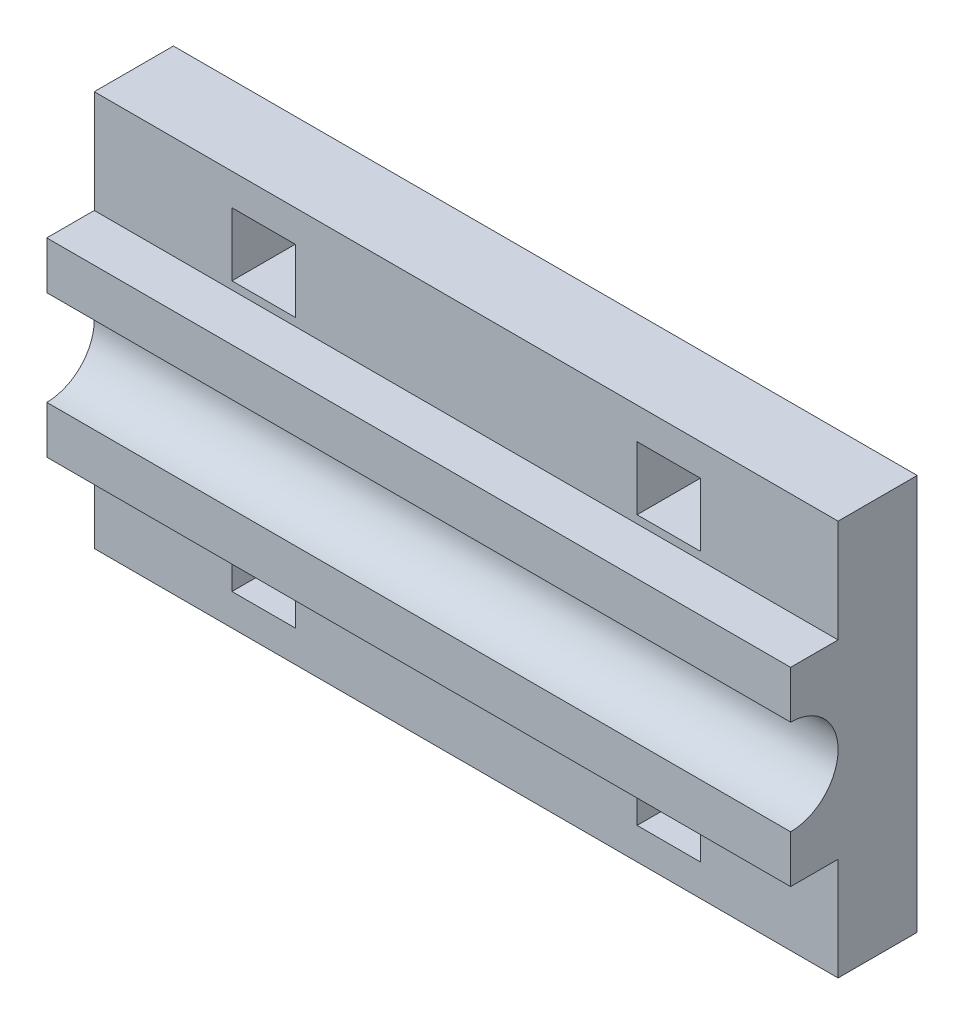
from build123d import *

# Parameters (mm, degrees)
ESQUISSE1_W             = 47
ESQUISSE1_H             = 25
BOSS_EXTRU_1_DEPTH      = 5
ESQUISSE2_W             = 4
ESQUISSE2_H             = 4
ENL_V_MAT_EXTRU_1_DEPTH = 5
ESQUISSE4_W             = 47
ESQUISSE4_H             = 12
BOSS_EXTRU_2_DEPTH      = 3
ESQUISSE5_R             = 3
ENL_V_MAT_EXTRU_2_DEPTH = 63


with BuildPart() as part:
    # Esquisse1 → Boss.-Extru.1 (new body)
    with BuildSketch(Plane.XY):
        with Locations((-12.5, -7.5)):
            Rectangle(ESQUISSE1_W, ESQUISSE1_H)
    extrude(amount=BOSS_EXTRU_1_DEPTH)

    # Esquisse2 → Enlèv. mat.-Extru.1 (cut)
    with BuildSketch(Plane.XY.offset(5)):
        with Locations((-25.3, -16)):
            Rectangle(ESQUISSE2_W, ESQUISSE2_H)
        with Locations((-25.3, 1)):
            Rectangle(ESQUISSE2_W, ESQUISSE2_H)
        with Locations((0.3, 1)):
            Rectangle(ESQUISSE2_W, ESQUISSE2_H)
        with Locations((0.3, -16)):
            Rectangle(ESQUISSE2_W, ESQUISSE2_H)
    extrude(amount=-ENL_V_MAT_EXTRU_1_DEPTH, mode=Mode.SUBTRACT)

    # Esquisse4 → Boss.-Extru.2 (add)
    with BuildSketch(Plane.XY.offset(5)):
        with Locations((-12.5, -7.5)):
            Rectangle(ESQUISSE4_W, ESQUISSE4_H)
    extrude(amount=BOSS_EXTRU_2_DEPTH)

    # Esquisse5 → Enlèv. mat.-Extru.2 (cut)
    with BuildSketch(Plane(origin=(11, 0, 0), x_dir=(0, 0, -1), z_dir=(1, 0, 0))):
        with Locations((-8, -7.5)):
            Circle(ESQUISSE5_R)
    extrude(amount=-ENL_V_MAT_EXTRU_2_DEPTH, mode=Mode.SUBTRACT)


solid = part.part
